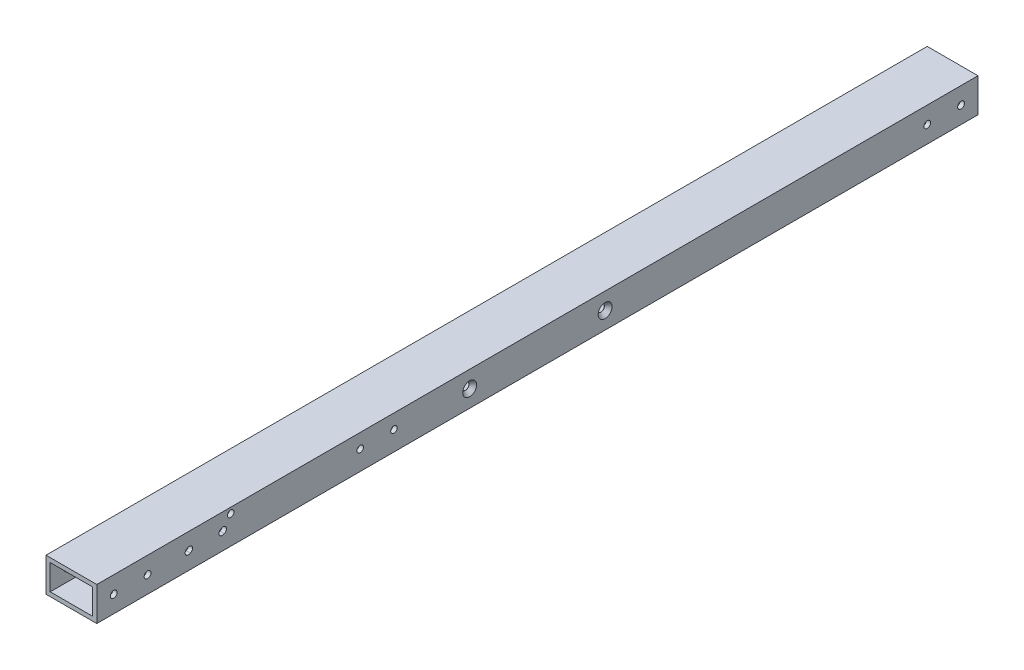
from build123d import *

# Parameters (mm, degrees)
BOSS_EXTRUDE1_DEPTH             = 330.5556
BOSS_EXTRUDE1_DEPTH_BACK        = 330.5556
SKETCH3_W                       = 38.1
SKETCH3_H                       = 25.4
SKETCH3_W_2                     = 31.75
SKETCH3_H_2                     = 19.05
F_10_CLEARANCE_HOLE2_D          = 5.1054
F_10_0_1935_DIAMETER_HOLE1_D    = 4.9149
F_10_0_1935_DIAMETER_HOLE2_D    = 4.9149
F_10_CLEARANCE_HOLE3_AT_2_COUNT = 2
F_10_CLEARANCE_HOLE3_AT_2_PITCH = 101.6


with BuildPart() as part:
    # Sketch3 → Boss-Extrude1 (new, two sides: drawn at the far end of the back side and taken through both)
    with BuildSketch(Plane.XY.offset(-BOSS_EXTRUDE1_DEPTH_BACK)):
        Rectangle(SKETCH3_W, SKETCH3_H)
        Rectangle(SKETCH3_W_2, SKETCH3_H_2, mode=Mode.SUBTRACT)
    extrude(amount=BOSS_EXTRUDE1_DEPTH + BOSS_EXTRUDE1_DEPTH_BACK)

    # #10 Clearance Hole2 (through all)
    with Locations(Plane.ZY.offset(19.05)):
        with Locations((-317.8556, 0), (-292.4556, 0), (292.4556, 0), (317.8556, 0)):
            Hole(F_10_CLEARANCE_HOLE2_D / 2)

    # #10 (0.1935) Diameter Hole1 (through all)
    with Locations(Plane(origin=(19.05, 0, 0), x_dir=(0, 0, -1), z_dir=(1, 0, 0))):
        with Locations((-261.128868491, 0.3559048), (-235.728868491, 0.3559048), (-230.046541854, 8.473619523), (-132.984885112, 1.9434048), (-107.584885112, 1.9434048)):
            Hole(F_10_0_1935_DIAMETER_HOLE1_D / 2)

    # #10 (0.1935) Diameter Hole2 (through all)
    with Locations(Plane(origin=(19.05, 0, 0), x_dir=(0, 0, -1), z_dir=(1, 0, 0))):
        with Locations((-261.840668479, 0), (-236.440668479, 0)):
            Hole(F_10_0_1935_DIAMETER_HOLE2_D / 2)

    # Sketch21 → #10 Clearance Hole3 (revolve, cut)
    with BuildSketch(Plane(origin=(-19.05, 0, -50.8), x_dir=(0, 0, 1), z_dir=(0, 1, 0))):
        Polygon((0, 0), (0, 38.1), (5.207, 38.1), (2.5527, 35.046577137), (2.5527, 0), align=None)
    f_10_clearance_hole3 = revolve(axis=Axis((-25.4, 0, -50.8), (1, 0, 0)), mode=Mode.SUBTRACT)

    # #10 Clearance Hole3 at 2: #10 Clearance Hole3 ×2
    with Locations(*[(0, 0, i * F_10_CLEARANCE_HOLE3_AT_2_PITCH) for i in range(1, F_10_CLEARANCE_HOLE3_AT_2_COUNT)]):
        add(f_10_clearance_hole3, mode=Mode.SUBTRACT)


solid = part.part
